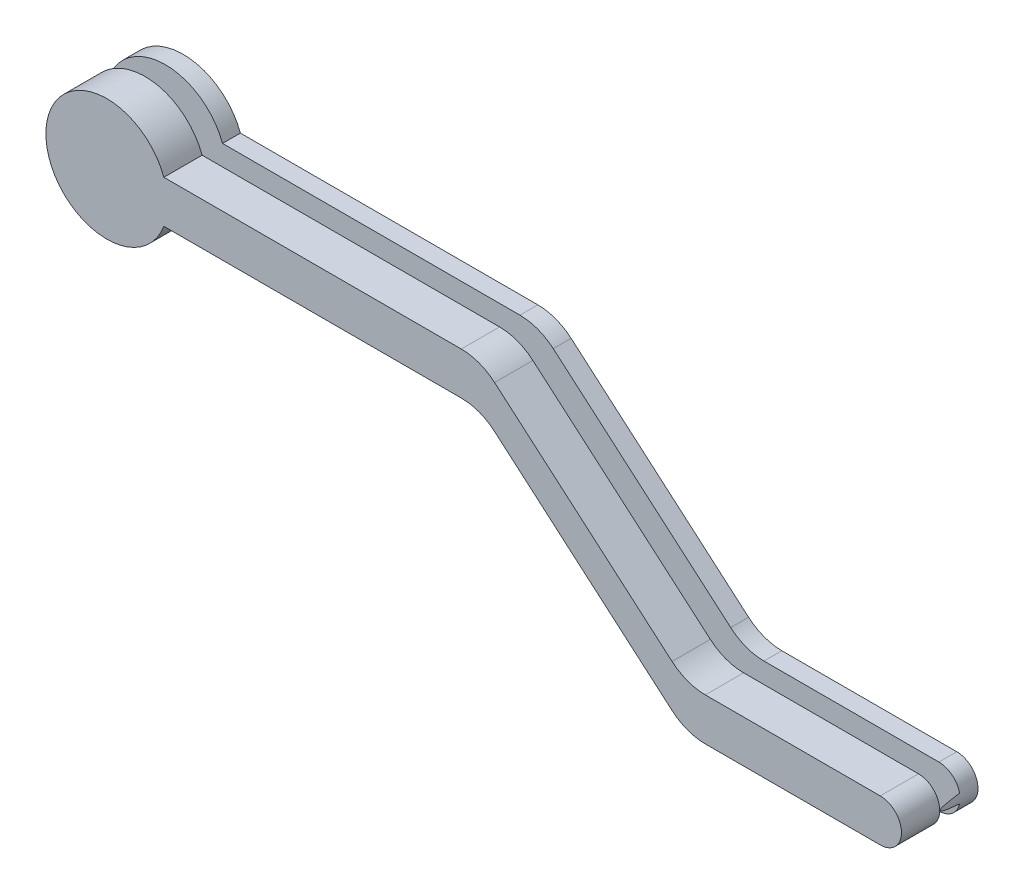
from build123d import *

# Parameters (mm, degrees)
EXTRUDE_1_DEPTH          = 15
CUT_EXTRUDE_1_DEPTH      = 163.316412297
CUT_EXTRUDE_1_DEPTH_BACK = 163.316412297


with BuildPart() as part:
    # 草图1 → 凸台-拉伸1 (new body)
    with BuildSketch(Plane.XY):
        with BuildLine():
            Line((11.187173962, -4.16175765), (69.487021894, -4.16175765))
            ThreePointArc((69.487021894, -4.16175765), (72.967546248, -4.787006975), (76.012831502, -6.584567606))
            Line((76.012831502, -6.584567606), (110.792662814, -36.53848931))
            ThreePointArc((110.792662814, -36.53848931), (113.837948067, -38.336049941), (117.318472421, -38.961299266))
            Line((117.318472421, -38.961299266), (151.600945406, -38.961299266))
            ThreePointArc((151.600945406, -38.961299266), (155.762703056, -34.799541616), (151.600945406, -30.637783966))
            Line((151.600945406, -30.637783966), (117.318472421, -30.637783966))
            ThreePointArc((117.318472421, -30.637783966), (113.837948067, -30.012534641), (110.792662814, -28.21497401))
            Line((110.792662814, -28.21497401), (76.012831502, 1.738947694))
            ThreePointArc((76.012831502, 1.738947694), (72.967546248, 3.536508325), (69.487021894, 4.16175765))
            Line((69.487021894, 4.16175765), (11.187173962, 4.16175765))
            ThreePointArc((11.187173962, 4.16175765), (-11.936209113, 0), (11.187173962, -4.16175765))
        make_face()
    extrude(amount=EXTRUDE_1_DEPTH)

    # 草图4 → 切除-拉伸1 (cut, two sides: drawn at the far end of the back side and taken through both)
    with BuildSketch(Plane(origin=(0, 4.16175765, 0), x_dir=(1, 0, 0), z_dir=(0, 1, 0)).offset(-CUT_EXTRUDE_1_DEPTH_BACK)):
        Polygon((-11.936209113, -3.503414807), (155.660228834, -3.503414807), (155.762703056, -7.5), (-11.936209113, -7.5), align=None)
    extrude(amount=CUT_EXTRUDE_1_DEPTH + CUT_EXTRUDE_1_DEPTH_BACK, mode=Mode.SUBTRACT)


with BuildPart() as cut_extrude_1_piece_1:
    # of the separate pieces the step leaves, piece 1, a body of its own (cut_extrude_1_pieces)
    add(part.part.solids().sort_by_distance((117.318472421, -30.637783966, 7.5))[0])


with BuildPart() as cut_extrude_1_piece_2:
    # of the separate pieces the step leaves, piece 2, a body of its own (cut_extrude_1_pieces)
    add(part.part.solids().sort_by_distance((117.318472421, -30.637783966, 0))[0])


solid = Compound([cut_extrude_1_piece_1.part, cut_extrude_1_piece_2.part])
